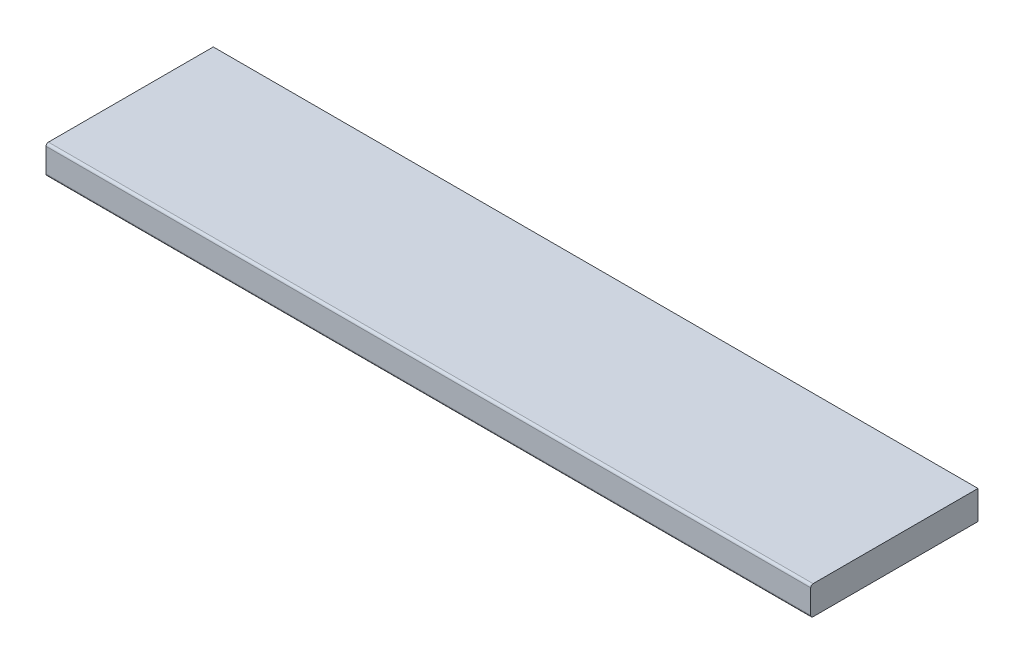
from build123d import *

# Parameters (mm, degrees)
SKETCH_1_W        = 1600
SKETCH_1_H        = 60
EXTRUDE_258_DEPTH = 350
FILLET_1_R        = 5


with BuildPart() as part:
    # Эскиз1 → Extrude 258 (new body)
    with BuildSketch(Plane.XY):
        with Locations((601.052631579, -1.263157895)):
            Rectangle(SKETCH_1_W, SKETCH_1_H)
    extrude(amount=EXTRUDE_258_DEPTH)

    # Скругление1
    fillet_1_edges = [part.edges().sort_by_distance(p)[0] for p in [
        (601.052631579, 28.736842105, 350),
        (601.052631579, -31.263157895, 350),
    ]]
    fillet(fillet_1_edges, radius=FILLET_1_R)


solid = part.part
